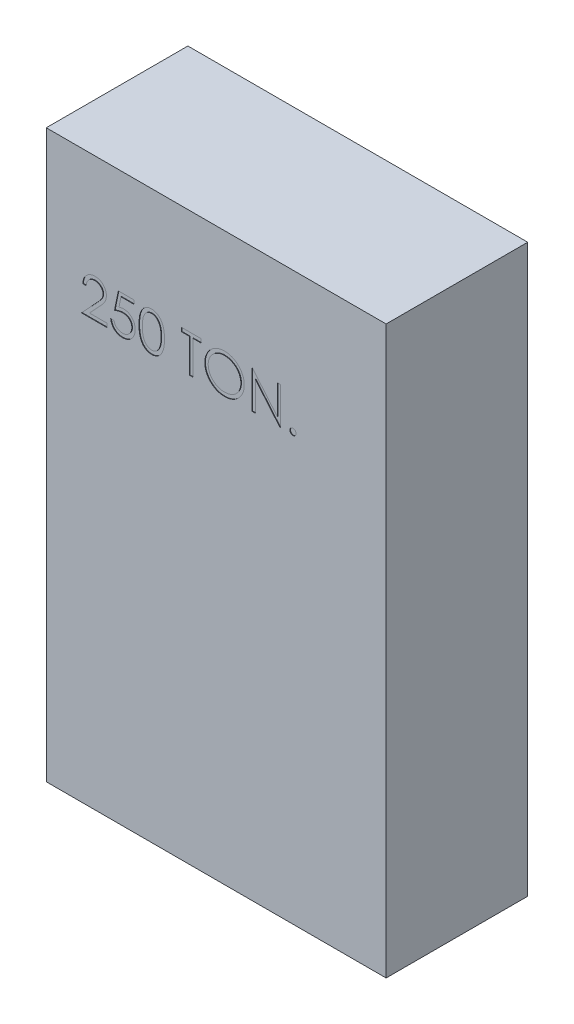
from build123d import *

# Parameters (mm, degrees)
CROQUIS1_W              = 1200
CROQUIS1_H              = 500
SALIENTE_EXTRUIR1_DEPTH = 2000
CORTAR_EXTRUIR1_DEPTH   = 2


with BuildPart() as part:
    # Croquis1 → Saliente-Extruir1 (new body)
    with BuildSketch(Plane(origin=(0, 0, 0), x_dir=(1, 0, 0), z_dir=(0, 1, 0))):
        Rectangle(CROQUIS1_W, CROQUIS1_H)
    extrude(amount=SALIENTE_EXTRUIR1_DEPTH)

    # Croquis2 → Cortar-Extruir1 (cut)
    # profile 1 of 7: a face of its own
    with BuildSketch(Plane.XY.offset(250)):
        with BuildLine():
            Line((-459.011736945, 1587.704360854), (-470.884066005, 1587.704360854))
            add(Edge.make_bspline(
                [(-470.884066005, 1587.704360854), (-470.806688495, 1589.279421195), (-470.654721126, 1592.372797788), (-469.943056621, 1596.882957345), (-468.924755608, 1601.193957178), (-467.48498934, 1605.271183093), (-465.696924674, 1609.150685628), (-463.552664711, 1612.817055269), (-461.012897147, 1616.256305556), (-458.132464044, 1619.436553502), (-455.004006556, 1622.354059899), (-451.628454677, 1624.873469374), (-448.081336087, 1627.002143262), (-444.373412376, 1628.781702104), (-440.462849408, 1630.117464138), (-436.385134245, 1631.108579682), (-432.122351411, 1631.704887988), (-429.21798153, 1631.768984646), (-427.740870225, 1631.801583076)],
                knots=[0, 0, 0, 0, 1.10065271, 2.161652631, 3.183658789, 4.190468796, 5.17591951, 6.163126047, 7.15150782, 8.156236427, 9.156009102, 10.134482811, 11.092018607, 12.041330605, 13.001268258, 13.972401359, 14.968799086, 16, 16, 16, 16], degree=3))
            add(Edge.make_bspline(
                [(-427.740870225, 1631.801583076), (-426.290270401, 1631.767623562), (-423.439893564, 1631.700894329), (-419.27981147, 1631.12784352), (-415.319479209, 1630.230316694), (-411.566638034, 1628.971073279), (-408.051230236, 1627.278328553), (-404.746847302, 1625.244909682), (-401.61414999, 1622.893148198), (-398.794191204, 1620.124328464), (-396.204748924, 1617.168464527), (-393.970824399, 1614.012820551), (-392.057767327, 1610.753558859), (-390.463173474, 1607.36582624), (-389.289325366, 1603.817724868), (-388.398125241, 1600.160910953), (-387.894380735, 1596.35753268), (-387.817068597, 1593.783267035), (-387.777762586, 1592.474493065)],
                knots=[0, 0, 0, 0, 1.111607364, 2.184268762, 3.212621178, 4.221274766, 5.211760367, 6.196651075, 7.1921475, 8.207485113, 9.220403448, 10.201281604, 11.166441695, 12.114753415, 13.065576456, 14.026450734, 14.996634279, 16, 16, 16, 16], degree=3))
            add(Edge.make_bspline(
                [(-387.777762586, 1592.474493065), (-387.841763891, 1590.631940985), (-387.968643367, 1586.979171004), (-389.053978434, 1581.611347322), (-390.749069776, 1576.410643684), (-392.790041299, 1572.225037326), (-394.848969989, 1568.852223723), (-396.704360901, 1566.075281602), (-398.876393936, 1563.085283243), (-401.396682401, 1559.892241027), (-404.213091557, 1556.471144316), (-407.35113166, 1552.824059788), (-410.833179939, 1548.988668488), (-413.277117318, 1546.369081769), (-414.54350444, 1545.011677561)],
                knots=[0, 0, 0, 0, 1.184426356, 2.348067706, 3.509069118, 4.696110526, 5.333549288, 6.050745305, 6.844228056, 7.710549037, 8.667450064, 9.695053472, 10.805634456, 12, 12, 12, 12], degree=3))
            Line((-414.54350444, 1545.011677561), (-447.642921841, 1509.686198461))
            Line((-447.642921841, 1509.686198461), (-386.081715578, 1509.686198461))
            Line((-386.081715578, 1509.686198461), (-386.081715578, 1496.117822392))
            Line((-386.081715578, 1496.117822392), (-475.972207031, 1496.117822392))
            Line((-475.972207031, 1496.117822392), (-424.666785022, 1550.868339887))
            add(Edge.make_bspline(
                [(-424.666785022, 1550.868339887), (-423.417653586, 1552.172293736), (-421.01832774, 1554.676922218), (-417.624760104, 1558.33357577), (-414.576798344, 1561.725894721), (-411.854712367, 1564.847469618), (-409.517553087, 1567.743960424), (-407.443513367, 1570.321557852), (-405.781718708, 1572.693526658), (-403.978190359, 1575.442948672), (-402.231411896, 1578.799842803), (-400.730379391, 1582.902157844), (-399.815115774, 1587.125181978), (-399.705319908, 1589.978979211), (-399.650091646, 1591.414463685)],
                knots=[0, 0, 0, 0, 1.329631726, 2.553950428, 3.673215718, 4.687767853, 5.603093632, 6.413772471, 7.123043292, 7.734684054, 8.834405432, 9.900288307, 10.943827018, 12, 12, 12, 12], degree=3))
            add(Edge.make_bspline(
                [(-399.650091646, 1591.414463685), (-399.674121191, 1592.317123685), (-399.721478811, 1594.096093207), (-400.139433448, 1596.704346599), (-400.771050791, 1599.220338073), (-401.676124533, 1601.651806712), (-402.870784054, 1603.974306061), (-404.324986212, 1606.1906632), (-406.002824918, 1608.333371111), (-407.943780634, 1610.342439222), (-410.07600177, 1612.182472882), (-412.328522513, 1613.812460634), (-414.711666335, 1615.174653215), (-417.215385238, 1616.291327066), (-419.832699112, 1617.167301296), (-422.568670133, 1617.774277364), (-425.415738605, 1618.155371251), (-427.359802282, 1618.206933701), (-428.350387119, 1618.233207008)],
                knots=[0, 0, 0, 0, 0.991446411, 1.95395049, 2.89581595, 3.838931463, 4.798493298, 5.75982156, 6.748411868, 7.785213223, 8.824556874, 9.840280684, 10.836137867, 11.835679398, 12.848801643, 13.863922112, 14.911575587, 16, 16, 16, 16], degree=3))
            add(Edge.make_bspline(
                [(-428.350387119, 1618.233207008), (-429.384939428, 1618.206180491), (-431.416629345, 1618.153104873), (-434.399580887, 1617.781831562), (-437.245204026, 1617.141319142), (-439.960656905, 1616.265296033), (-442.550534107, 1615.151833027), (-445.002240534, 1613.764972439), (-447.31027236, 1612.110060644), (-449.478968332, 1610.233765807), (-451.477100874, 1608.144782071), (-453.232682193, 1605.816072157), (-454.766661299, 1603.290154969), (-456.105046017, 1600.573846064), (-457.191942637, 1597.642497832), (-458.022475406, 1594.506516131), (-458.679656815, 1591.179517487), (-458.899205064, 1588.881986006), (-459.011736945, 1587.704360854)],
                knots=[0, 0, 0, 0, 1.031018746, 2.02475058, 2.990194455, 3.934040569, 4.864654155, 5.795059489, 6.735614925, 7.690564532, 8.649604399, 9.611025574, 10.590972636, 11.591080095, 12.624614302, 13.701020113, 14.821632451, 16, 16, 16, 16], degree=3))
        make_face()
    # profile 2 of 7: a face of its own
    with BuildSketch(Plane.XY.offset(250)):
        with BuildLine():
            Line((-291.103083099, 1628.409489059), (-291.103083099, 1614.841112991))
            Line((-291.103083099, 1614.841112991), (-336.101330294, 1614.841112991))
            Line((-336.101330294, 1614.841112991), (-343.230027877, 1580.045648581))
            add(Edge.make_bspline(
                [(-343.230027877, 1580.045648581), (-341.829404054, 1580.432328498), (-339.11591692, 1581.181459679), (-335.110886461, 1582.013225406), (-331.308740675, 1582.514627607), (-328.841487091, 1582.583090832), (-327.647595986, 1582.616219828)],
                knots=[0, 0, 0, 0, 1.100273476, 2.13160584, 3.095893838, 4, 4, 4, 4], degree=3))
            add(Edge.make_bspline(
                [(-327.647595986, 1582.616219828), (-326.170323682, 1582.584245473), (-323.265637235, 1582.521375902), (-319.015712751, 1581.917678021), (-314.958784941, 1580.967449105), (-311.103338211, 1579.639977004), (-307.442240018, 1577.942496017), (-304.00917445, 1575.822051843), (-300.752610477, 1573.345047957), (-297.730970765, 1570.497185898), (-294.989724593, 1567.362946217), (-292.579522008, 1563.992990972), (-290.532305053, 1560.42007041), (-288.885812234, 1556.610047401), (-287.571047219, 1552.605043686), (-286.695956937, 1548.362919285), (-286.113242045, 1543.923659987), (-286.048139943, 1540.88833844), (-286.014942073, 1539.340520376)],
                knots=[0, 0, 0, 0, 1.052922333, 2.070308379, 3.05430497, 4.020497103, 4.973039431, 5.925935799, 6.892292201, 7.88610001, 8.88166317, 9.857072816, 10.836096531, 11.812156883, 12.81219415, 13.836441305, 14.89672472, 16, 16, 16, 16], degree=3))
            add(Edge.make_bspline(
                [(-286.014942073, 1539.340520376), (-286.040080335, 1538.262448357), (-286.090017137, 1536.120873529), (-286.343963753, 1532.940423086), (-286.832903021, 1529.827304097), (-287.489361641, 1526.781103573), (-288.341411367, 1523.807588612), (-289.372872631, 1520.898248122), (-290.635162956, 1518.07119007), (-292.019741724, 1515.299664722), (-293.578760387, 1512.646328289), (-295.309078968, 1510.164952905), (-297.137179381, 1507.818314885), (-299.104219843, 1505.631581524), (-301.228483646, 1503.619122217), (-303.484244299, 1501.76899372), (-305.853501833, 1500.049907723), (-308.37291129, 1498.531645584), (-310.986332521, 1497.134533848), (-313.731506205, 1495.988376336), (-316.545943395, 1494.963662923), (-319.47015149, 1494.146874231), (-322.497506907, 1493.506863986), (-325.632999909, 1493.072168665), (-328.860185949, 1492.755559273), (-331.047723627, 1492.735739828), (-332.152720853, 1492.725728375)],
                knots=[0, 0, 0, 0, 1.056347294, 2.098418968, 3.122841568, 4.141288669, 5.149314143, 6.15115421, 7.162517403, 8.180376062, 9.185164535, 10.17417709, 11.141909838, 12.097768115, 13.052685741, 14.0056014, 14.954263652, 15.917497458, 16.885230207, 17.854509472, 18.828990115, 19.81800267, 20.826176721, 21.857883937, 22.917946725, 24, 24, 24, 24], degree=3))
            add(Edge.make_bspline(
                [(-332.152720853, 1492.725728375), (-333.470881849, 1492.751840406), (-336.064207891, 1492.803212742), (-339.863645992, 1493.340637631), (-343.519227814, 1494.110345186), (-347.00152628, 1495.268323242), (-350.341749641, 1496.719271583), (-353.494929747, 1498.553067351), (-356.541636164, 1500.63114657), (-359.358013743, 1503.083469435), (-361.971950175, 1505.763913369), (-364.311868814, 1508.672728973), (-366.395786744, 1511.76190729), (-368.190332538, 1515.046450613), (-369.72106132, 1518.51772842), (-370.923592127, 1522.188746608), (-371.894172804, 1526.040324138), (-372.304784233, 1528.691959799), (-372.513339509, 1530.038762563)],
                knots=[0, 0, 0, 0, 1.0467383, 2.05933395, 3.04377827, 4.011590433, 4.970194871, 5.932262533, 6.905835911, 7.896367577, 8.894135286, 9.877477877, 10.858688626, 11.851381753, 12.8477658, 13.868841284, 14.917554742, 16, 16, 16, 16], degree=3))
            Line((-372.513339509, 1530.038762563), (-360.641010449, 1530.038762563))
            add(Edge.make_bspline(
                [(-360.641010449, 1530.038762563), (-360.348889381, 1528.777212128), (-359.787416468, 1526.352442144), (-358.554996798, 1522.94569204), (-357.048161624, 1519.909816621), (-355.256390121, 1517.204656777), (-353.118933612, 1514.845745273), (-350.679874839, 1512.743552753), (-347.945303159, 1510.847052329), (-344.906630496, 1509.266251307), (-341.700898033, 1507.918057354), (-338.345708845, 1507.020299837), (-334.932419559, 1506.389045852), (-332.62380259, 1506.325857274), (-331.463701755, 1506.294104444)],
                knots=[0, 0, 0, 0, 1.136247022, 2.183929868, 3.172523383, 4.106158343, 5.02341133, 5.958108904, 6.928429099, 7.938127109, 8.96079061, 9.975095812, 10.982467395, 12, 12, 12, 12], degree=3))
            add(Edge.make_bspline(
                [(-331.463701755, 1506.294104444), (-330.331343886, 1506.325127894), (-328.101721976, 1506.386213322), (-324.820458253, 1506.856378363), (-321.652531162, 1507.580488945), (-318.629199523, 1508.664141202), (-315.697557997, 1509.981188594), (-312.931763698, 1511.671311996), (-310.251803759, 1513.616378169), (-307.740978474, 1515.844798412), (-305.441392148, 1518.300498179), (-303.409538759, 1520.926578228), (-301.717078044, 1523.728018558), (-300.290818571, 1526.656319276), (-299.207792098, 1529.743574265), (-298.435171677, 1532.975315112), (-297.981484632, 1536.359524186), (-297.919073961, 1538.667798692), (-297.887271133, 1539.844034331)],
                knots=[0, 0, 0, 0, 1.027316725, 2.022795036, 3.002884548, 3.971462791, 4.93288096, 5.914575861, 6.907176829, 7.935150275, 8.956128384, 9.956726525, 10.942570165, 11.921478529, 12.907843606, 13.90538589, 14.932640048, 16, 16, 16, 16], degree=3))
            add(Edge.make_bspline(
                [(-297.887271133, 1539.844034331), (-297.912160089, 1540.905230896), (-297.960876679, 1542.982372178), (-298.358907163, 1546.021270755), (-299.051245106, 1548.896650628), (-300.012207235, 1551.622396972), (-301.232295772, 1554.201080656), (-302.723272458, 1556.63536299), (-304.513118154, 1558.893159663), (-306.557662752, 1560.975527017), (-308.797475609, 1562.897342228), (-311.271093261, 1564.535645495), (-313.926751208, 1565.913894764), (-316.732453331, 1567.103310177), (-319.754936105, 1567.957564542), (-322.934344531, 1568.598910212), (-326.305011766, 1568.969907551), (-328.609558609, 1569.021383689), (-329.794155481, 1569.04784376)],
                knots=[0, 0, 0, 0, 1.045622112, 2.046656509, 3.013763289, 3.955457236, 4.890082067, 5.820317437, 6.762574623, 7.722996705, 8.69280354, 9.665887285, 10.63943826, 11.638615906, 12.663482002, 13.728887084, 14.832589034, 16, 16, 16, 16], degree=3))
            add(Edge.make_bspline(
                [(-329.794155481, 1569.04784376), (-330.819564398, 1569.025898796), (-332.936773661, 1568.980588015), (-336.184451934, 1568.64696745), (-339.597264082, 1568.108756024), (-343.162127455, 1567.368442503), (-346.889747851, 1566.399648828), (-350.772258831, 1565.238713834), (-354.81782367, 1563.850709716), (-357.543701943, 1562.802498066), (-358.944963441, 1562.263655726)],
                knots=[0, 0, 0, 0, 0.817624296, 1.688186739, 2.600797293, 3.572016777, 4.590301741, 5.671205678, 6.80286297, 8, 8, 8, 8], degree=3))
            Line((-358.944963441, 1562.263655726), (-345.376587372, 1628.409489059))
            Line((-345.376587372, 1628.409489059), (-291.103083099, 1628.409489059))
        make_face()
    # profile 3 of 7: a face of its own
    with BuildSketch(Plane.XY.offset(250)):
        with BuildLine():
            add(Edge.make_bspline(
                [(-272.446566005, 1562.210654257), (-272.4341677, 1564.331001948), (-272.410083813, 1568.4498079), (-272.142158378, 1574.451489311), (-271.697078475, 1580.081833568), (-271.087124204, 1585.341110171), (-270.344855309, 1590.230676866), (-269.353972333, 1594.737466793), (-268.227119377, 1598.882338829), (-266.921119193, 1602.678809114), (-265.447473596, 1606.178025865), (-263.843559575, 1609.4446927), (-262.045723595, 1612.473866928), (-260.156715279, 1615.313896506), (-258.100068524, 1617.918292113), (-255.93431067, 1620.323833226), (-253.574912371, 1622.474924092), (-251.102078427, 1624.434590878), (-248.493420398, 1626.152472694), (-245.823295815, 1627.665614898), (-243.07332604, 1628.958288452), (-240.236003055, 1629.974682903), (-237.336828992, 1630.814200028), (-234.365669031, 1631.388306085), (-231.317617477, 1631.749534471), (-229.260238841, 1631.784068936), (-228.21684011, 1631.801583076)],
                knots=[0, 0, 0, 0, 1.646270934, 3.197905019, 4.663502075, 6.030701355, 7.308322542, 8.50163776, 9.611534131, 10.641858119, 11.616356847, 12.558055219, 13.465016945, 14.349605745, 15.204443733, 16.039544428, 16.859896111, 17.680448484, 18.487036065, 19.28249412, 20.06191084, 20.843045899, 21.620316918, 22.403196591, 23.190181807, 24, 24, 24, 24], degree=3))
            add(Edge.make_bspline(
                [(-228.21684011, 1631.801583076), (-227.164725298, 1631.783144824), (-225.072399962, 1631.746476942), (-221.979028636, 1631.394054114), (-218.957121023, 1630.809282497), (-216.019560424, 1629.98072185), (-213.142217185, 1628.952790024), (-210.347597015, 1627.664378157), (-207.618341251, 1626.164611445), (-204.997821455, 1624.402339892), (-202.457269029, 1622.437533619), (-200.059087096, 1620.216444649), (-197.803057361, 1617.761499903), (-195.660865758, 1615.098965167), (-193.693288126, 1612.177772972), (-191.81953042, 1609.048730727), (-190.14237311, 1605.657117682), (-188.527104138, 1602.059522618), (-187.132863865, 1598.156402181), (-185.875478999, 1593.969757959), (-184.859517985, 1589.450138396), (-184.013256798, 1584.621256506), (-183.357661029, 1579.465378419), (-182.880177236, 1573.993556374), (-182.62795051, 1568.202190419), (-182.580450196, 1564.242593143), (-182.556074552, 1562.210654257)],
                knots=[0, 0, 0, 0, 0.810914788, 1.612654377, 2.396697861, 3.181598691, 3.963628158, 4.749916497, 5.551656086, 6.361998678, 7.18212741, 8.025565596, 8.878627764, 9.750805457, 10.657531673, 11.591944965, 12.560506719, 13.57287815, 14.630710178, 15.753379473, 16.941251878, 18.199788006, 19.531962791, 20.947069417, 22.433333509, 24, 24, 24, 24], degree=3))
            add(Edge.make_bspline(
                [(-182.556074552, 1562.210654257), (-182.580702896, 1560.187577974), (-182.628690221, 1556.245696342), (-182.877349673, 1550.480388644), (-183.367155078, 1545.037605459), (-183.979854041, 1539.904293337), (-184.828446986, 1535.101817863), (-185.871856544, 1530.613560436), (-187.03036577, 1526.420138679), (-188.460430904, 1522.555906217), (-190.025657159, 1518.966957168), (-191.7286363, 1515.615550073), (-193.553120798, 1512.472062225), (-195.540850147, 1509.561655124), (-197.659535706, 1506.863711836), (-199.954523556, 1504.425855265), (-202.361120076, 1502.189344747), (-204.909148889, 1500.19923859), (-207.570537879, 1498.457342701), (-210.290419656, 1496.899557284), (-213.11705349, 1495.643440537), (-215.986382358, 1494.564883929), (-218.939448578, 1493.740878753), (-221.972571083, 1493.171122905), (-225.070321667, 1492.771532204), (-227.164368919, 1492.741049185), (-228.21684011, 1492.725728375)],
                knots=[0, 0, 0, 0, 1.561518951, 3.042555995, 4.452378317, 5.7783523, 7.031515105, 8.214008947, 9.334062868, 10.386615937, 11.391082383, 12.354592575, 13.286541444, 14.194233754, 15.072674879, 15.931287219, 16.775624067, 17.606195743, 18.42308326, 19.229000347, 20.022332153, 20.807536673, 21.593273796, 22.3848459, 23.188221202, 24, 24, 24, 24], degree=3))
            add(Edge.make_bspline(
                [(-228.21684011, 1492.725728375), (-229.260209895, 1492.743355501), (-231.317531456, 1492.778112753), (-234.366001108, 1493.137709152), (-237.324891083, 1493.715842755), (-240.208802322, 1494.525339398), (-243.032530719, 1495.516197794), (-245.757598697, 1496.807125716), (-248.414305789, 1498.29385987), (-250.995564008, 1499.987020145), (-253.452868904, 1501.926857573), (-255.800048331, 1504.072412532), (-257.978136851, 1506.477225995), (-260.005377965, 1509.103326064), (-261.932077132, 1511.926552784), (-263.704383802, 1514.985452598), (-265.343698822, 1518.267896506), (-266.84212838, 1521.795091344), (-268.170664173, 1525.618506772), (-269.344193617, 1529.78188346), (-270.270770402, 1534.321968515), (-271.063876154, 1539.20229757), (-271.703577537, 1544.443841962), (-272.140303524, 1550.049447269), (-272.410228229, 1556.015620344), (-272.434232379, 1560.107960028), (-272.446566005, 1562.210654257)],
                knots=[0, 0, 0, 0, 0.810891512, 1.598919785, 2.382837074, 3.152667961, 3.926044502, 4.706494248, 5.493654104, 6.291793342, 7.103789334, 7.925228297, 8.761435821, 9.622817696, 10.50288917, 11.416980706, 12.369136599, 13.353924996, 14.394355917, 15.514179734, 16.714354668, 17.994756427, 19.357759367, 20.818452758, 22.365282078, 24, 24, 24, 24], degree=3))
        make_face()
        with BuildLine():
            add(Edge.make_bspline(
                [(-260.574236945, 1562.263655726), (-260.56972213, 1560.496666217), (-260.560959761, 1557.067286548), (-260.332049799, 1552.083925195), (-260.020210673, 1547.435939553), (-259.617994976, 1543.117427907), (-259.020681148, 1539.143007791), (-258.351406727, 1535.485344175), (-257.536940244, 1532.163793844), (-256.573289271, 1529.155564094), (-255.47568055, 1526.409602279), (-254.277274393, 1523.854437302), (-252.989860164, 1521.459884943), (-251.549047033, 1519.247453912), (-249.979876489, 1517.209929258), (-248.317791991, 1515.311247798), (-246.500762766, 1513.618028563), (-243.98707964, 1511.587281364), (-240.668581946, 1509.488790298), (-236.48739212, 1507.661423212), (-232.190995312, 1506.513038698), (-229.274861752, 1506.366997922), (-227.819329093, 1506.294104444)],
                knots=[0, 0, 0, 0, 1.459021318, 2.831673884, 4.118529203, 5.306027144, 6.411944654, 7.436330062, 8.375795394, 9.233974572, 10.042671642, 10.816086306, 11.563610507, 12.285937304, 12.993564865, 13.685989202, 14.367179055, 15.041617293, 16.353048772, 17.594441528, 18.799311195, 20, 20, 20, 20], degree=3))
            add(Edge.make_bspline(
                [(-227.819329093, 1506.294104444), (-226.354381384, 1506.354496754), (-223.427510538, 1506.475156687), (-219.151322447, 1507.63927563), (-214.999999739, 1509.39571358), (-211.746685329, 1511.472598457), (-209.271601096, 1513.450484719), (-207.498250577, 1515.1368122), (-205.870607675, 1517.025025042), (-204.326874488, 1519.062290096), (-202.911010616, 1521.287529825), (-201.623505114, 1523.69004383), (-200.448628585, 1526.276503829), (-199.779268812, 1528.08208623), (-199.437042434, 1529.005233917)],
                knots=[0, 0, 0, 0, 1.353760809, 2.704726607, 4.075137775, 5.516104923, 6.260822281, 7.007110065, 7.778089737, 8.566572457, 9.372053459, 10.217411131, 11.088608312, 12, 12, 12, 12], degree=3))
            add(Edge.make_bspline(
                [(-199.437042434, 1529.005233917), (-199.038210735, 1530.185643713), (-198.228411343, 1532.582381826), (-197.184752018, 1536.300293675), (-196.362827702, 1540.201112431), (-195.623379056, 1544.261526069), (-195.118665337, 1548.511479054), (-194.712423584, 1552.937821541), (-194.473138691, 1557.543890887), (-194.443476969, 1560.673344423), (-194.428403612, 1562.263655726)],
                knots=[0, 0, 0, 0, 0.884706709, 1.796334032, 2.740027952, 3.714592787, 4.726048262, 5.777819803, 6.87074269, 8, 8, 8, 8], degree=3))
            add(Edge.make_bspline(
                [(-194.428403612, 1562.263655726), (-194.449199455, 1563.853709806), (-194.489880569, 1566.964195499), (-194.645379509, 1571.51949578), (-195.046925331, 1575.8461046), (-195.492903931, 1579.962661156), (-196.150477466, 1583.846377954), (-196.859477905, 1587.529767469), (-197.812023726, 1590.967197276), (-198.829527126, 1594.212485037), (-199.994086719, 1597.228759775), (-201.276020722, 1600.030084438), (-202.645116961, 1602.629983261), (-204.132159978, 1605.021323017), (-205.719496809, 1607.214814966), (-207.449023222, 1609.166479701), (-209.252134932, 1610.936805579), (-211.777665468, 1612.9575634), (-215.08398535, 1615.0179757), (-219.198091663, 1616.91412198), (-223.479452324, 1618.00300685), (-226.373746571, 1618.156528949), (-227.819329093, 1618.233207008)],
                knots=[0, 0, 0, 0, 1.31362396, 2.569729283, 3.763502607, 4.902122613, 5.988968491, 7.01645872, 7.998833611, 8.933434873, 9.825090667, 10.667526885, 11.477055099, 12.250526234, 12.991942729, 13.710640831, 14.402115721, 15.076753259, 16.378508321, 17.609869233, 18.806226677, 20, 20, 20, 20], degree=3))
            add(Edge.make_bspline(
                [(-227.819329093, 1618.233207008), (-229.282497305, 1618.156423161), (-232.211499273, 1618.002715586), (-236.537359467, 1616.918178918), (-240.683922758, 1615.027807884), (-243.981499479, 1612.950739044), (-246.50879141, 1610.972475486), (-248.288405118, 1609.256975586), (-249.957025318, 1607.380465376), (-251.494167555, 1605.324202523), (-252.933851771, 1603.114350842), (-254.256050758, 1600.733525509), (-255.447330779, 1598.169661444), (-256.546656997, 1595.424933082), (-257.513247497, 1592.41696286), (-258.310549084, 1589.099503876), (-259.047113294, 1585.453474038), (-259.568541612, 1581.457528351), (-260.032082381, 1577.137935054), (-260.329978568, 1572.478345942), (-260.561725502, 1567.486626802), (-260.569982935, 1564.039515751), (-260.574236945, 1562.263655726)],
                knots=[0, 0, 0, 0, 1.207732386, 2.417664972, 3.655092373, 4.956220595, 5.625982001, 6.301752483, 6.994047911, 7.697131622, 8.419323945, 9.170223765, 9.943494443, 10.752040957, 11.610060368, 12.549350801, 13.567764191, 14.679664412, 15.874934091, 17.154273443, 18.533957287, 20, 20, 20, 20], degree=3))
        make_face(mode=Mode.SUBTRACT)
    # profile 4 of 7: a face of its own
    with BuildSketch(Plane.XY.offset(250)):
        Polygon((-123.194429253, 1614.841112991), (-123.194429253, 1628.409489059), (-53.656501902, 1628.409489059), (-53.656501902, 1614.841112991), (-82.489301048, 1614.841112991), (-82.489301048, 1496.117822392), (-94.361630107, 1496.117822392), (-94.361630107, 1614.841112991), align=None)
    # profile 5 of 7: a face of its own
    with BuildSketch(Plane.XY.offset(250)):
        with BuildLine():
            add(Edge.make_bspline(
                [(28.601778012, 1631.801583076), (31.05137011, 1631.739539064), (35.862571094, 1631.617679506), (42.933556811, 1630.684868151), (49.684026187, 1629.071084066), (56.168968933, 1626.921798716), (62.310816559, 1624.054683555), (68.155798507, 1620.589203245), (73.690007726, 1616.489051382), (78.838851612, 1611.785922867), (83.55058753, 1606.668750651), (87.701744541, 1601.207829645), (91.180724096, 1595.436178486), (94.037686884, 1589.371141138), (96.279033144, 1583.026434015), (97.825675569, 1576.368232126), (98.813635411, 1569.439675685), (98.929136521, 1564.713957882), (98.987728867, 1562.316657195)],
                knots=[0, 0, 0, 0, 1.065120563, 2.091984664, 3.0946048, 4.079830382, 5.057816894, 6.036188127, 7.030412546, 8.04752943, 9.064399622, 10.05169764, 11.02544977, 11.989514704, 12.962713494, 13.945757189, 14.957906945, 16, 16, 16, 16], degree=3))
            add(Edge.make_bspline(
                [(98.987728867, 1562.316657195), (98.929145108, 1559.937015621), (98.813669732, 1555.246466396), (97.824552247, 1548.361877882), (96.273300165, 1541.743866437), (94.058500818, 1535.403480157), (91.215156841, 1529.334030574), (87.713011979, 1523.551487972), (83.587734073, 1518.053956634), (78.893010835, 1512.901662443), (73.77517383, 1508.177055663), (68.285815531, 1504.060181493), (62.548389451, 1500.517632736), (56.489064172, 1497.690987917), (50.188199685, 1495.431751638), (43.589403544, 1493.891399253), (36.723596294, 1492.897811606), (32.041567281, 1492.78371889), (29.661807393, 1492.725728375)],
                knots=[0, 0, 0, 0, 1.043624062, 2.057103931, 3.04512605, 4.022047818, 4.998200453, 5.980619268, 6.982898556, 8.009068085, 9.034988726, 10.034168286, 11.015286542, 11.987931943, 12.962482838, 13.94673481, 14.956375938, 16, 16, 16, 16], degree=3))
            add(Edge.make_bspline(
                [(29.661807393, 1492.725728375), (27.264519145, 1492.784291509), (22.538825864, 1492.899735036), (15.60156292, 1493.889329801), (8.938683911, 1495.436813605), (2.56924266, 1497.648330986), (-3.510312714, 1500.506482266), (-9.311872388, 1503.991588261), (-14.812149679, 1508.126917704), (-19.965543073, 1512.820118589), (-24.680765743, 1517.929281418), (-28.791611193, 1523.403671416), (-32.277500893, 1529.135886593), (-35.126055425, 1535.141834677), (-37.38122993, 1541.39248147), (-38.919775139, 1547.929522137), (-39.915211423, 1554.715687981), (-40.029921394, 1559.336178484), (-40.088125834, 1561.680639567)],
                knots=[0, 0, 0, 0, 1.053102029, 2.075944431, 3.073151272, 4.055350789, 5.033113405, 6.020478099, 7.024410459, 8.052272461, 9.079885166, 10.07527673, 11.055994387, 12.023226415, 12.992069828, 13.970394897, 14.97016774, 16, 16, 16, 16], degree=3))
            add(Edge.make_bspline(
                [(-40.088125834, 1561.680639567), (-40.067917885, 1563.254255334), (-40.027756919, 1566.381635003), (-39.5442614, 1571.025699949), (-38.842673289, 1575.595078978), (-37.837184332, 1580.076778499), (-36.522142158, 1584.459827623), (-34.970473265, 1588.774454671), (-33.075306491, 1592.976934705), (-30.932912949, 1597.087175999), (-28.541767229, 1601.041105773), (-25.900630271, 1604.778518589), (-23.102269618, 1608.330776503), (-20.034486585, 1611.605826946), (-16.798388805, 1614.698944315), (-13.341479869, 1617.562594631), (-9.684853371, 1620.222600218), (-5.812775326, 1622.61973811), (-1.820656008, 1624.787776829), (2.294626962, 1626.648245601), (6.477181897, 1628.24504614), (10.746598648, 1629.539267807), (15.091539736, 1630.561014406), (19.521488141, 1631.256768549), (24.03291467, 1631.741497231), (27.072271071, 1631.781468288), (28.601778012, 1631.801583076)],
                knots=[0, 0, 0, 0, 1.037015668, 2.060948919, 3.074880161, 4.083647147, 5.086022904, 6.090072063, 7.104153813, 8.122640571, 9.144368836, 10.147691507, 11.138137339, 12.123020368, 13.103399296, 14.087645067, 15.080126199, 16.082011238, 17.087798457, 18.072939717, 19.057185487, 20.037253025, 21.01195951, 21.997135196, 22.992090687, 24, 24, 24, 24], degree=3))
        make_face()
        with BuildLine():
            add(Edge.make_bspline(
                [(29.184794171, 1618.233207008), (27.929360106, 1618.21790312), (25.43049401, 1618.187441651), (21.71557255, 1617.786192878), (18.049508385, 1617.214319099), (14.431544398, 1616.398588998), (10.876818579, 1615.287185813), (7.352196606, 1614.008080057), (3.889819273, 1612.450020978), (0.501116907, 1610.68968364), (-2.784065993, 1608.741257169), (-5.883950839, 1606.587860023), (-8.80656268, 1604.27999205), (-11.544745675, 1601.812267244), (-14.090459623, 1599.172118605), (-16.493809946, 1596.399571168), (-18.658463776, 1593.415377667), (-20.642293615, 1590.300460503), (-22.417566149, 1587.058876928), (-23.996197116, 1583.724754158), (-25.287515306, 1580.270895163), (-26.340646791, 1576.734770755), (-27.213764641, 1573.121981357), (-27.766892129, 1569.405120404), (-28.172549763, 1565.602864681), (-28.201270112, 1563.03331246), (-28.215796774, 1561.733641036)],
                knots=[0, 0, 0, 0, 1.008559885, 2.007477868, 2.99961109, 3.989939068, 4.984837346, 5.991145699, 7.001802488, 8.033829008, 9.059044045, 10.069351652, 11.065060232, 12.050310815, 13.029377138, 14.011219647, 14.996725999, 15.989392538, 16.977580475, 17.965360261, 18.951710183, 19.937753436, 20.929683414, 21.935841486, 22.955955122, 24, 24, 24, 24], degree=3))
            add(Edge.make_bspline(
                [(-28.215796774, 1561.733641036), (-28.167610028, 1559.822509475), (-28.07281179, 1556.062722469), (-27.242867919, 1550.553033697), (-25.964477814, 1545.258030016), (-24.07998807, 1540.20668404), (-21.72328329, 1535.355575731), (-18.811850235, 1530.747739631), (-15.362474084, 1526.381930392), (-11.444239597, 1522.28862707), (-7.160911103, 1518.552491017), (-2.612620418, 1515.27304075), (2.151905817, 1512.498308093), (7.145092348, 1510.23781875), (12.340282068, 1508.446599494), (17.770951407, 1507.218984567), (23.400924136, 1506.411043248), (27.238541161, 1506.333453962), (29.184794171, 1506.294104444)],
                knots=[0, 0, 0, 0, 1.032063989, 2.030389145, 3.003944642, 3.970395727, 4.937377036, 5.913328081, 6.909231446, 7.93887556, 8.970685674, 9.976071282, 10.964166581, 11.944589148, 12.933237628, 13.927779006, 14.949070134, 16, 16, 16, 16], degree=3))
            add(Edge.make_bspline(
                [(29.184794171, 1506.294104444), (30.492950929, 1506.312077377), (33.087418673, 1506.3477231), (36.946386333, 1506.706750469), (40.735832431, 1507.282478867), (44.45044182, 1508.111405433), (48.085998678, 1509.148844485), (51.657677249, 1510.381338965), (55.127434055, 1511.918991604), (58.53904102, 1513.617917155), (61.80461325, 1515.554673109), (64.921992001, 1517.634984123), (67.812601954, 1519.939452822), (70.548736498, 1522.370512999), (73.104902124, 1524.977182248), (75.463813135, 1527.756071586), (77.617526463, 1530.724721428), (79.600602987, 1533.834913847), (81.369654883, 1537.085367446), (82.911007734, 1540.431578487), (84.21865854, 1543.865307323), (85.274289526, 1547.391506603), (86.10150787, 1551.00347916), (86.671492938, 1554.706061281), (87.070198803, 1558.491845953), (87.100250828, 1561.052402413), (87.115399807, 1562.343157929)],
                knots=[0, 0, 0, 0, 1.047197238, 2.076906641, 3.100256066, 4.114471768, 5.12198147, 6.126382909, 7.136867548, 8.15857795, 9.17633901, 10.174870724, 11.156907918, 12.133735059, 13.104061851, 14.077631395, 15.04955518, 16.038496417, 17.029181396, 18.010275684, 18.986308667, 19.968651475, 20.955262928, 21.950658345, 22.966943676, 24, 24, 24, 24], degree=3))
            add(Edge.make_bspline(
                [(87.115399807, 1562.343157929), (87.100238692, 1563.625083239), (87.070163826, 1566.168018231), (86.671683386, 1569.927400354), (86.100905685, 1573.603340192), (85.278327137, 1577.181406555), (84.218098112, 1580.662511521), (82.910779374, 1584.043385615), (81.369192162, 1587.336623941), (79.599952728, 1590.534086953), (77.611199877, 1593.602298776), (75.43805437, 1596.535485201), (73.042995081, 1599.278562031), (70.494451879, 1601.899248383), (67.72876663, 1604.341650758), (64.758467419, 1606.606579366), (61.619614122, 1608.748694198), (58.296173974, 1610.681118708), (54.86626858, 1612.46570429), (51.346782668, 1613.994655897), (47.777587534, 1615.293840171), (44.167759478, 1616.401951648), (40.486914762, 1617.211124216), (36.759924802, 1617.786708243), (32.991945981, 1618.187301996), (30.457871902, 1618.21785678), (29.184794171, 1618.233207008)],
                knots=[0, 0, 0, 0, 1.02996197, 2.043119294, 3.035359645, 4.018872909, 4.991431989, 5.957985074, 6.929999688, 7.912076566, 8.892894881, 9.867085534, 10.843653904, 11.817741046, 12.803660682, 13.806313499, 14.818574707, 15.856120519, 16.894564902, 17.924820532, 18.937903209, 19.946497019, 20.957711757, 21.963978472, 22.977135795, 24, 24, 24, 24], degree=3))
        make_face(mode=Mode.SUBTRACT)
    # profile 6 of 7: a face of its own
    with BuildSketch(Plane.XY.offset(250)):
        Polygon((126.124481004, 1496.117822392), (126.124481004, 1628.409489059), (128.615550047, 1628.409489059), (216.014972457, 1524.288103175), (216.014972457, 1628.409489059), (227.887301516, 1628.409489059), (227.887301516, 1496.117822392), (225.184226597, 1496.117822392), (137.996810063, 1600.000701666), (137.996810063, 1496.117822392), align=None)
    # profile 7 of 7: a face of its own
    with BuildSketch(Plane.XY.offset(250)):
        with BuildLine():
            add(Edge.make_bspline(
                [(271.136500234, 1516.470386495), (271.873183849, 1516.426610552), (273.317365952, 1516.340792933), (275.40527348, 1515.752031752), (277.294952583, 1514.70660024), (278.978165406, 1513.313274987), (280.365582823, 1511.623885339), (281.448271132, 1509.749278074), (282.031903609, 1507.643890497), (282.117096109, 1506.191340283), (282.16080579, 1505.446080939)],
                knots=[0, 0, 0, 0, 1.020151414, 1.999887582, 2.974338812, 3.990962822, 5.007586832, 5.987933904, 6.967670073, 8, 8, 8, 8], degree=3))
            add(Edge.make_bspline(
                [(282.16080579, 1505.446080939), (282.115614928, 1504.718728892), (282.026499213, 1503.284401336), (281.449608965, 1501.194893671), (280.357331472, 1499.319114841), (278.987735013, 1497.606801882), (277.294536483, 1496.210524928), (275.400805978, 1495.173987791), (273.322267351, 1494.543070693), (271.874001558, 1494.462701725), (271.136500234, 1494.421775384)],
                knots=[0, 0, 0, 0, 1.009421747, 1.99056486, 2.972319754, 3.999869655, 5.017953583, 5.993804169, 6.978383603, 8, 8, 8, 8], degree=3))
            add(Edge.make_bspline(
                [(271.136500234, 1494.421775384), (270.398467491, 1494.461220872), (268.957634249, 1494.538228799), (266.88685411, 1495.186942012), (264.981590714, 1496.200804944), (263.288721848, 1497.609405392), (261.907654619, 1499.310303669), (260.863480921, 1501.207812046), (260.236412791, 1503.278419948), (260.153943199, 1504.717550793), (260.112194679, 1505.446080939)],
                knots=[0, 0, 0, 0, 1.022052826, 1.995314843, 2.982371812, 4.00089066, 5.028879526, 6.005146991, 6.990147033, 8, 8, 8, 8], degree=3))
            add(Edge.make_bspline(
                [(260.112194679, 1505.446080939), (260.152339502, 1506.192560468), (260.230717342, 1507.649970134), (260.864797358, 1509.736364971), (261.899552986, 1511.632612526), (263.298268809, 1513.310697548), (264.981181183, 1514.716289048), (266.882257986, 1515.739273788), (268.962621563, 1516.345563177), (270.399306735, 1516.428057114), (271.136500234, 1516.470386495)],
                knots=[0, 0, 0, 0, 1.032775665, 2.016367738, 2.991239715, 4.008302682, 5.025365648, 6.011011707, 6.979408107, 8, 8, 8, 8], degree=3))
        make_face()
    extrude(amount=-CORTAR_EXTRUIR1_DEPTH, mode=Mode.SUBTRACT)


solid = part.part
